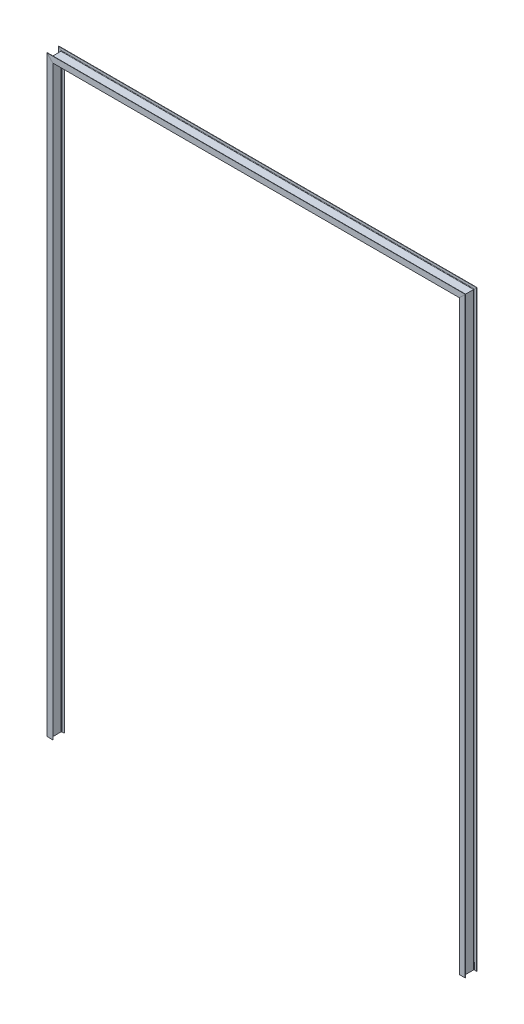
from build123d import *

# Parameters (mm, degrees)
W_SECTION_W8X10_1_DEPTH   = 10113.001976112
W_SECTION_W8X10_1_2_DEPTH = 7226.003952224
W_SECTION_W8X10_1_3_DEPTH = 10113.001976113


with BuildPart() as part:
    # Sketch11 → W section W8X10(1) (new body)
    with BuildSketch(Plane(origin=(0, 0, 0), x_dir=(-1, 0, 0), z_dir=(0, 1, 0))):
        with BuildLine():
            Line((-50.038, -100.203), (-50.038, -94.996))
            Line((-50.038, -94.996), (-9.779, -94.996))
            ThreePointArc((-9.779, -94.996), (-4.390846327, -92.764153673), (-2.159, -87.376))
            Line((-2.159, -87.376), (-2.159, 87.376))
            ThreePointArc((-2.159, 87.376), (-4.390846327, 92.764153673), (-9.779, 94.996))
            Line((-9.779, 94.996), (-50.038, 94.996))
            Line((-50.038, 94.996), (-50.038, 100.203))
            Line((-50.038, 100.203), (50.038, 100.203))
            Line((50.038, 100.203), (50.038, 94.996))
            Line((50.038, 94.996), (9.779, 94.996))
            ThreePointArc((9.779, 94.996), (4.390846327, 92.764153673), (2.159, 87.376))
            Line((2.159, 87.376), (2.159, -87.376))
            ThreePointArc((2.159, -87.376), (4.390846327, -92.764153673), (9.779, -94.996))
            Line((9.779, -94.996), (50.038, -94.996))
            Line((50.038, -94.996), (50.038, -100.203))
            Line((50.038, -100.203), (-50.038, -100.203))
        make_face()
    extrude(amount=W_SECTION_W8X10_1_DEPTH)

    # W section W8X10(1) mitre 1
    split(bisect_by=Plane(origin=(0, 10000, 0), x_dir=(0.707106781, -0.707106781, 0), z_dir=(-0.707106781, -0.707106781, 0)), keep=Keep.TOP)


with BuildPart() as body_2:
    # Sketch11 on segment 2 (carried to segment 2) → W section W8X10_1 2 (new body)
    with BuildSketch(Plane(origin=(-113.001976112, 10000, 0), x_dir=(0, 1, 0), z_dir=(1, 0, 0))):
        with BuildLine():
            Line((-50.038, -100.203), (-50.038, -94.996))
            Line((-50.038, -94.996), (-9.779, -94.996))
            ThreePointArc((-9.779, -94.996), (-4.390846327, -92.764153673), (-2.159, -87.376))
            Line((-2.159, -87.376), (-2.159, 87.376))
            ThreePointArc((-2.159, 87.376), (-4.390846327, 92.764153673), (-9.779, 94.996))
            Line((-9.779, 94.996), (-50.038, 94.996))
            Line((-50.038, 94.996), (-50.038, 100.203))
            Line((-50.038, 100.203), (50.038, 100.203))
            Line((50.038, 100.203), (50.038, 94.996))
            Line((50.038, 94.996), (9.779, 94.996))
            ThreePointArc((9.779, 94.996), (4.390846327, 92.764153673), (2.159, 87.376))
            Line((2.159, 87.376), (2.159, -87.376))
            ThreePointArc((2.159, -87.376), (4.390846327, -92.764153673), (9.779, -94.996))
            Line((9.779, -94.996), (50.038, -94.996))
            Line((50.038, -94.996), (50.038, -100.203))
            Line((50.038, -100.203), (-50.038, -100.203))
        make_face()
    extrude(amount=W_SECTION_W8X10_1_2_DEPTH)

    # W section W8X10_1 2 mitre 1
    split(bisect_by=Plane(origin=(0, 10000, 0), x_dir=(-0.707106781, 0.707106781, 0), z_dir=(0.707106781, 0.707106781, 0)), keep=Keep.TOP)

    # W section W8X10_1 2 mitre 2
    split(bisect_by=Plane(origin=(7000, 10000, 0), x_dir=(-0.707106781, -0.707106781, 0), z_dir=(-0.707106781, 0.707106781, 0)), keep=Keep.TOP)


with BuildPart() as body_3:
    # Sketch11 on segment 3 (carried to segment 3) → W section W8X10_1 3 (new body)
    with BuildSketch(Plane(origin=(7000, 10113.001976112, 0), x_dir=(1, 0, 0), z_dir=(0, -1, 0))):
        with BuildLine():
            Line((-50.038, -100.203), (-50.038, -94.996))
            Line((-50.038, -94.996), (-9.779, -94.996))
            ThreePointArc((-9.779, -94.996), (-4.390846327, -92.764153673), (-2.159, -87.376))
            Line((-2.159, -87.376), (-2.159, 87.376))
            ThreePointArc((-2.159, 87.376), (-4.390846327, 92.764153673), (-9.779, 94.996))
            Line((-9.779, 94.996), (-50.038, 94.996))
            Line((-50.038, 94.996), (-50.038, 100.203))
            Line((-50.038, 100.203), (50.038, 100.203))
            Line((50.038, 100.203), (50.038, 94.996))
            Line((50.038, 94.996), (9.779, 94.996))
            ThreePointArc((9.779, 94.996), (4.390846327, 92.764153673), (2.159, 87.376))
            Line((2.159, 87.376), (2.159, -87.376))
            ThreePointArc((2.159, -87.376), (4.390846327, -92.764153673), (9.779, -94.996))
            Line((9.779, -94.996), (50.038, -94.996))
            Line((50.038, -94.996), (50.038, -100.203))
            Line((50.038, -100.203), (-50.038, -100.203))
        make_face()
    extrude(amount=W_SECTION_W8X10_1_3_DEPTH)

    # W section W8X10_1 3 mitre 1
    split(bisect_by=Plane(origin=(7000, 10000, 0), x_dir=(0.707106781, 0.707106781, 0), z_dir=(0.707106781, -0.707106781, 0)), keep=Keep.TOP)


solid = Compound([part.part, body_2.part, body_3.part])
